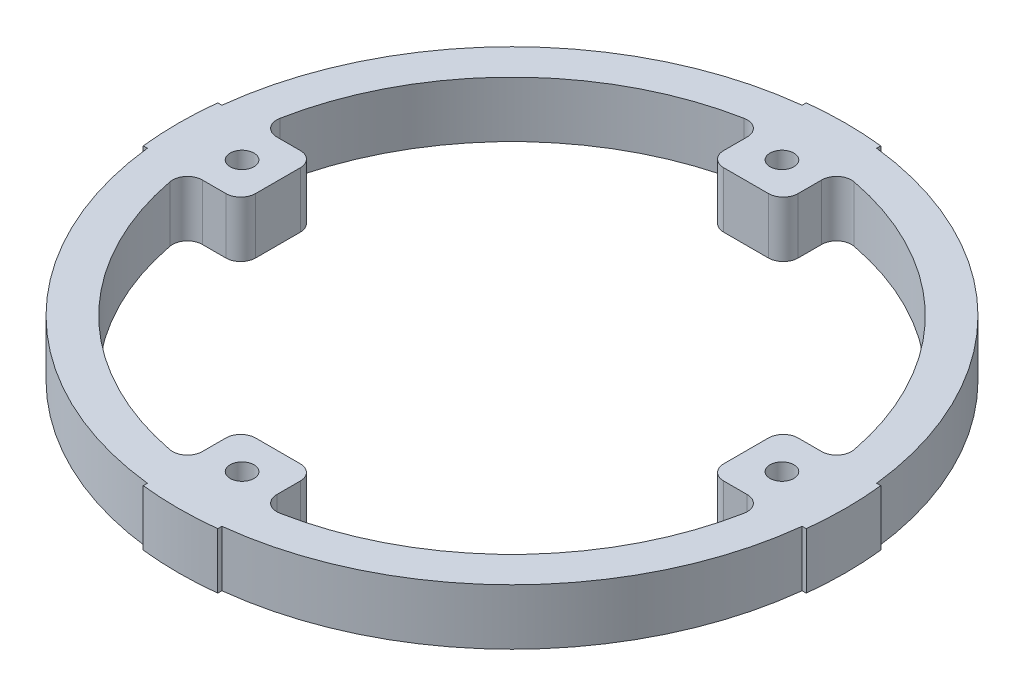
from build123d import *

# Parameters (mm, degrees)
SKETCH1_R           = 1.6
BOSS_EXTRUDE1_DEPTH = 7.5


with BuildPart() as part:
    # Sketch1 → Boss-Extrude1 (new body)
    with BuildSketch(Plane(origin=(0, 0, 0), x_dir=(1, 0, 0), z_dir=(0, 1, 0))):
        with BuildLine():
            Line((-5, 43.966606646), (-5, 44.520107817))
            ThreePointArc((-5, 44.520107817), (0, 44.8), (5, 44.520107817))
            Line((5, 44.520107817), (5, 43.966606646))
            ThreePointArc((5, 43.966606646), (31.289475068, 31.289475068), (43.966606646, 5))
            Line((43.966606646, 5), (44.520107817, 5))
            ThreePointArc((44.520107817, 5), (44.8, 0), (44.520107817, -5))
            Line((44.520107817, -5), (43.966606646, -5))
            ThreePointArc((43.966606646, -5), (31.289475068, -31.289475068), (5, -43.966606646))
            Line((5, -43.966606646), (5, -44.520107817))
            ThreePointArc((5, -44.520107817), (0, -44.8), (-5, -44.520107817))
            Line((-5, -44.520107817), (-5, -43.966606646))
            ThreePointArc((-5, -43.966606646), (-31.289475068, -31.289475068), (-43.966606646, -5))
            Line((-43.966606646, -5), (-44.520107817, -5))
            ThreePointArc((-44.520107817, -5), (-44.8, 0), (-44.520107817, 5))
            Line((-44.520107817, 5), (-43.966606646, 5))
            ThreePointArc((-43.966606646, 5), (-31.289475068, 31.289475068), (-5, 43.966606646))
        make_face()
        with Locations(Location((36.25, 0, 0), (0, 0, 270))):
            Circle(SKETCH1_R, mode=Mode.SUBTRACT)
        with Locations(Location((0, -36.25, 0), (0, 0, 270))):
            Circle(SKETCH1_R, mode=Mode.SUBTRACT)
        with Locations(Location((-36.25, 0, 0), (0, 0, 270))):
            Circle(SKETCH1_R, mode=Mode.SUBTRACT)
        with Locations(Location((0, 36.25, 0), (0, 0, 270))):
            Circle(SKETCH1_R, mode=Mode.SUBTRACT)
        with BuildLine():
            Line((33.430226046, 5), (36.586370413, 5))
            ThreePointArc((36.586370413, 5), (38.127746073, 5.725574218), (38.550739294, 7.375838926))
            ThreePointArc((38.550739294, 7.375838926), (36.262271651, 15.02032472), (32.474994896, 22.043983453))
            ThreePointArc((32.474994896, 22.043983453), (21.567115852, 32.79362764), (7.375838926, 38.550739294))
            ThreePointArc((7.375838926, 38.550739294), (5.725574218, 38.127746073), (5, 36.586370413))
            Line((5, 36.586370413), (5, 33.430226046))
            ThreePointArc((5, 33.430226046), (4.414213562, 32.016012484), (3, 31.430226046))
            Line((3, 31.430226046), (-3, 31.430226046))
            ThreePointArc((-3, 31.430226046), (-4.414213562, 32.016012484), (-5, 33.430226046))
            Line((-5, 33.430226046), (-5, 36.586370413))
            ThreePointArc((-5, 36.586370413), (-5.725574218, 38.127746073), (-7.375838926, 38.550739294))
            ThreePointArc((-7.375838926, 38.550739294), (-27.753941162, 27.753941162), (-38.550739294, 7.375838926))
            ThreePointArc((-38.550739294, 7.375838926), (-38.127746073, 5.725574218), (-36.586370413, 5))
            Line((-36.586370413, 5), (-33.430226046, 5))
            ThreePointArc((-33.430226046, 5), (-32.016012484, 4.414213562), (-31.430226046, 3))
            Line((-31.430226046, 3), (-31.430226046, -3))
            ThreePointArc((-31.430226046, -3), (-32.016012484, -4.414213562), (-33.430226046, -5))
            Line((-33.430226046, -5), (-36.586370413, -5))
            ThreePointArc((-36.586370413, -5), (-38.127746073, -5.725574218), (-38.550739294, -7.375838926))
            ThreePointArc((-38.550739294, -7.375838926), (-32.79362764, -21.567115852), (-22.043983453, -32.474994896))
            ThreePointArc((-22.043983453, -32.474994896), (-15.02032472, -36.262271651), (-7.375838926, -38.550739294))
            ThreePointArc((-7.375838926, -38.550739294), (-5.725574218, -38.127746073), (-5, -36.586370413))
            Line((-5, -36.586370413), (-5, -33.430226046))
            ThreePointArc((-5, -33.430226046), (-4.414213562, -32.016012484), (-3, -31.430226046))
            Line((-3, -31.430226046), (3, -31.430226046))
            ThreePointArc((3, -31.430226046), (4.414213562, -32.016012484), (5, -33.430226046))
            Line((5, -33.430226046), (5, -36.586370413))
            ThreePointArc((5, -36.586370413), (5.725574218, -38.127746073), (7.375838926, -38.550739294))
            ThreePointArc((7.375838926, -38.550739294), (27.753941162, -27.753941162), (38.550739294, -7.375838926))
            ThreePointArc((38.550739294, -7.375838926), (38.127746073, -5.725574218), (36.586370413, -5))
            Line((36.586370413, -5), (33.430226046, -5))
            ThreePointArc((33.430226046, -5), (32.016012484, -4.414213562), (31.430226046, -3))
            Line((31.430226046, -3), (31.430226046, 3))
            ThreePointArc((31.430226046, 3), (32.016012484, 4.414213562), (33.430226046, 5))
        make_face(mode=Mode.SUBTRACT)
    extrude(amount=BOSS_EXTRUDE1_DEPTH)


solid = part.part
